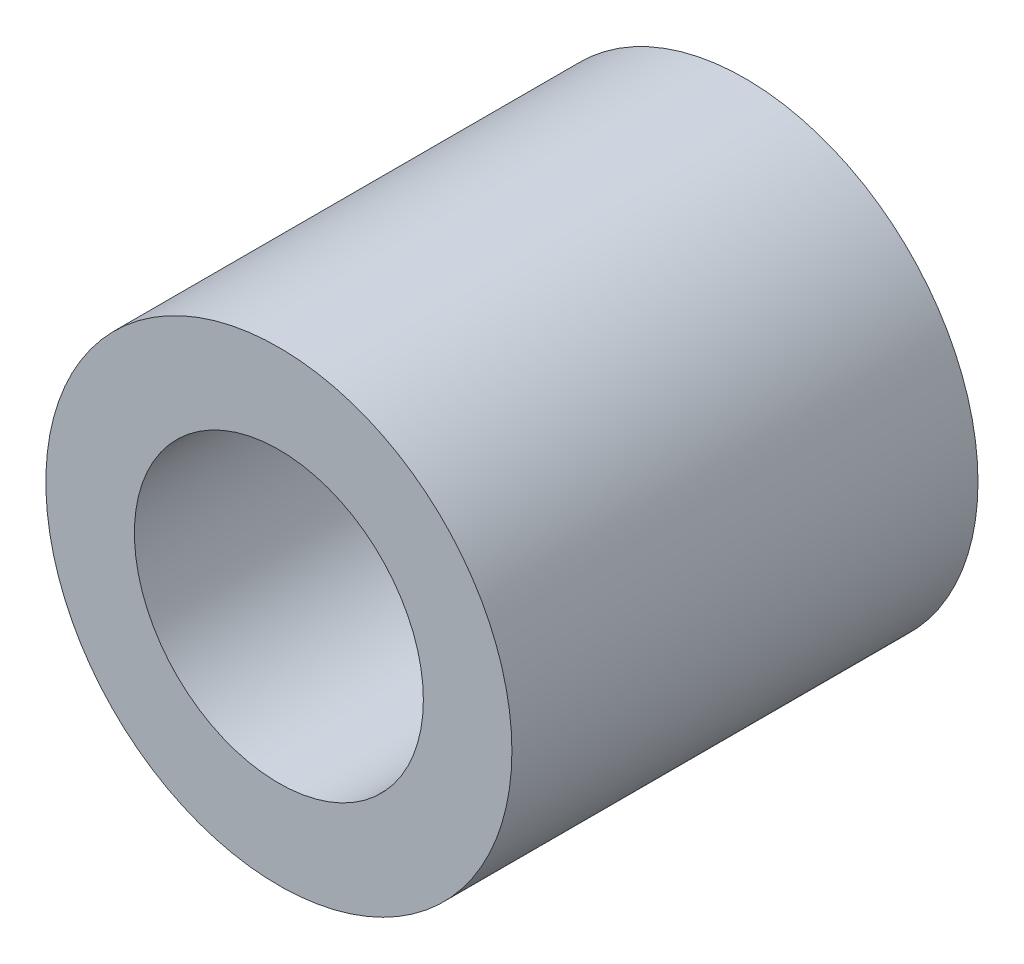
from build123d import *

# Parameters (mm, degrees)
SKETCH1_R           = 2.5
SKETCH1_R_2         = 1.55
BOSS_EXTRUDE1_DEPTH = 5


with BuildPart() as part:
    # Sketch1 → Boss-Extrude1 (new body)
    with BuildSketch(Plane.XY):
        Circle(SKETCH1_R)
        Circle(SKETCH1_R_2, mode=Mode.SUBTRACT)
    extrude(amount=BOSS_EXTRUDE1_DEPTH)


solid = part.part
